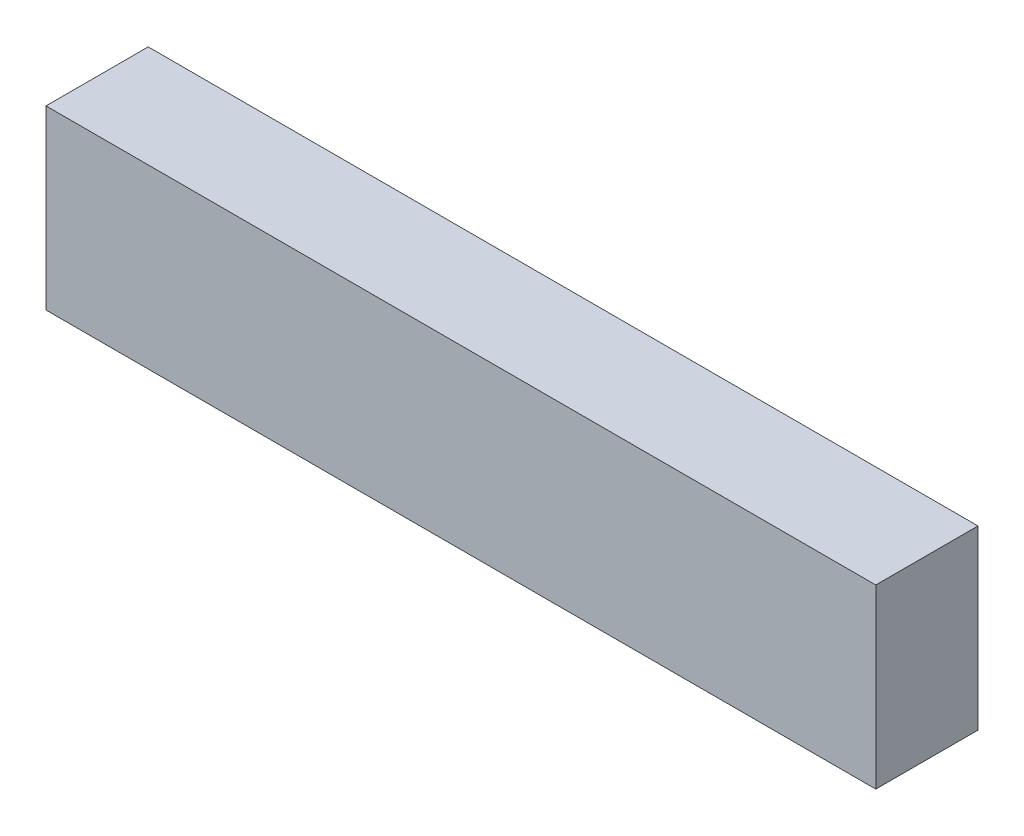
from build123d import *

# Parameters (mm, degrees)
SKETCH1_W                 = 58.85230149
SKETCH1_H                 = 12.54
BOSS_EXTRUDE1_DEPTH       = 7.25
SHELL1_T                  = -0.5
SHELL1_THICKNESS_2_FACE_W = 57.85230149
SHELL1_THICKNESS_2_FACE_H = 11.54
SHELL1_THICKNESS_2_DEPTH  = 0.3


with BuildPart() as part:
    # Sketch1 → Boss-Extrude1 (new body)
    with BuildSketch(Plane.XY):
        with Locations((49.610650745, 7.98)):
            Rectangle(SKETCH1_W, SKETCH1_H)
    extrude(amount=BOSS_EXTRUDE1_DEPTH)

    # Shell1
    shell1_openings = [part.faces().sort_by_distance(p)[0] for p in [
        (49.610650745, 7.98, 0),
    ]]
    offset(amount=SHELL1_T, openings=shell1_openings, kind=Kind.INTERSECTION)

    # Shell1 thickness 2 face (on inner face of the shell) → Shell1 thickness 2 (cut)
    with BuildSketch(Plane(origin=(49.610650745, 7.98, 6.75), x_dir=(1, 0, 0), z_dir=(0, 0, 1))):
        Rectangle(SHELL1_THICKNESS_2_FACE_W, SHELL1_THICKNESS_2_FACE_H)
    extrude(amount=SHELL1_THICKNESS_2_DEPTH, mode=Mode.SUBTRACT)


solid = part.part
